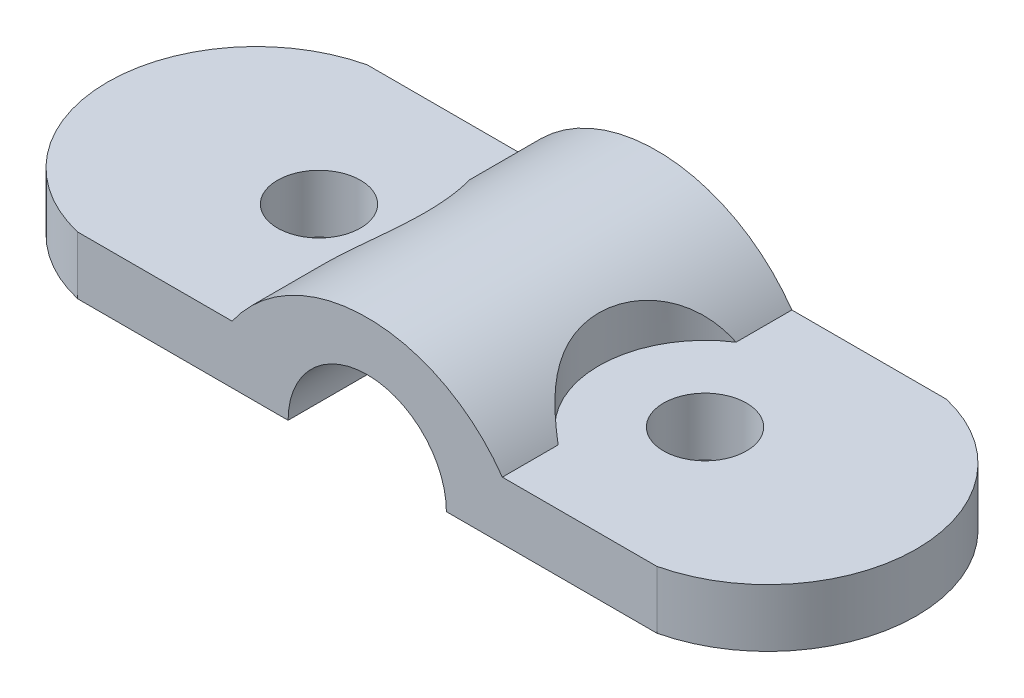
from build123d import *

# Parameters (mm, degrees)
AUFSATZ_LINEAR_AUSTRAGEN1_DEPTH = 15
AUFSATZ_LINEAR_AUSTRAGEN2_DEPTH = 3
SKIZZE3_8_R                     = 5.5
SCHNITT_LINEAR_AUSTRAGEN1_DEPTH = 3
SKIZZE3_9_R                     = 2.15
SCHNITT_LINEAR_AUSTRAGEN2_DEPTH = 3


with BuildPart() as part:
    # Skizze2 → Aufsatz-Linear austragen1 (new body)
    with BuildSketch(Plane.XY):
        with BuildLine():
            ThreePointArc((-4.1, 0), (0, 4.1), (4.1, 0))
            Line((4.1, 0), (10, 0))
            Line((10, 0), (15, 0))
            Line((15, 0), (15, 3))
            Line((15, 3), (7, 3))
            ThreePointArc((7, 3), (0, 6.657308815), (-7, 3))
            Line((-7, 3), (-15, 3))
            Line((-15, 3), (-15, 0))
            Line((-15, 0), (-10, 0))
            Line((-10, 0), (-4.1, 0))
        make_face()
    extrude(amount=AUFSATZ_LINEAR_AUSTRAGEN1_DEPTH)

    # Skizze3 → Aufsatz-Linear austragen2 (add)
    with BuildSketch(Plane(origin=(0, 3, 0), x_dir=(1, 0, 0), z_dir=(0, 1, 0))):
        with BuildLine():
            ThreePointArc((15, -15), (20.956440423, -7.5), (15, 0))
            Line((15, 0), (15, -15))
        make_face()
        with BuildLine():
            Line((-15, -15), (-15, 0))
            ThreePointArc((-15, 0), (-20.956440423, -7.5), (-15, -15))
        make_face()
    extrude(amount=-AUFSATZ_LINEAR_AUSTRAGEN2_DEPTH)

    # Skizze3<8> → Schnitt-Linear austragen1 (cut)
    with BuildSketch(Plane(origin=(0, 3, 0), x_dir=(1, 0, 0), z_dir=(0, 1, 0))):
        with Locations((-10, -7.5)):
            Circle(SKIZZE3_8_R)
        with Locations((10, -7.5)):
            Circle(SKIZZE3_8_R)
    extrude(amount=SCHNITT_LINEAR_AUSTRAGEN1_DEPTH, mode=Mode.SUBTRACT)

    # Skizze3<9> → Schnitt-Linear austragen2 (cut)
    with BuildSketch(Plane(origin=(0, 3, 0), x_dir=(1, 0, 0), z_dir=(0, 1, 0))):
        with Locations(Location((10, -7.5, 0), (0, 0, 180))):
            Circle(SKIZZE3_9_R)
        with Locations(Location((-10, -7.5, 0), (0, 0, 180))):
            Circle(SKIZZE3_9_R)
    extrude(amount=-SCHNITT_LINEAR_AUSTRAGEN2_DEPTH, mode=Mode.SUBTRACT)


solid = part.part
